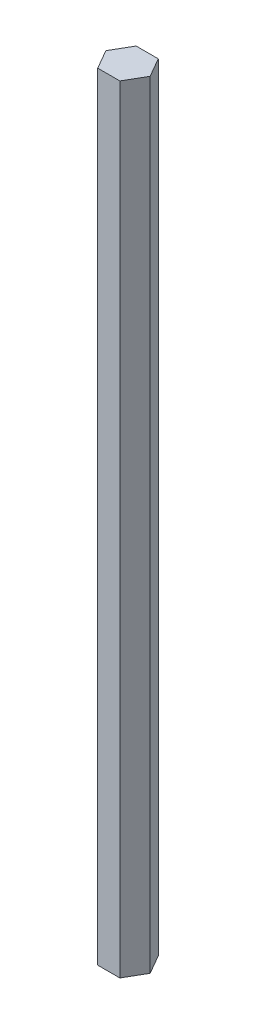
from build123d import *

# Parameters (mm, degrees)
BOSS_EXTRUDE1_DEPTH = 105.2
SKETCH3_R           = 1.6
CUT_EXTRUDE1_DEPTH  = 5


with BuildPart() as part:
    # Sketch1 → Boss-Extrude1 (new body)
    with BuildSketch(Plane(origin=(0, 0, 0), x_dir=(1, 0, 0), z_dir=(0, 1, 0))):
        Polygon((3, 0), (1.5, 2.598076211), (-1.5, 2.598076211), (-3, 0), (-1.5, -2.598076211), (1.5, -2.598076211), align=None)
    extrude(amount=BOSS_EXTRUDE1_DEPTH)

    # Sketch3 → Cut-Extrude1 (cut)
    with BuildSketch(Plane.XZ):
        with Locations(Location((0, 0, 0), (0, 0, 270))):
            Circle(SKETCH3_R)
    extrude(amount=-CUT_EXTRUDE1_DEPTH, mode=Mode.SUBTRACT)


solid = part.part
